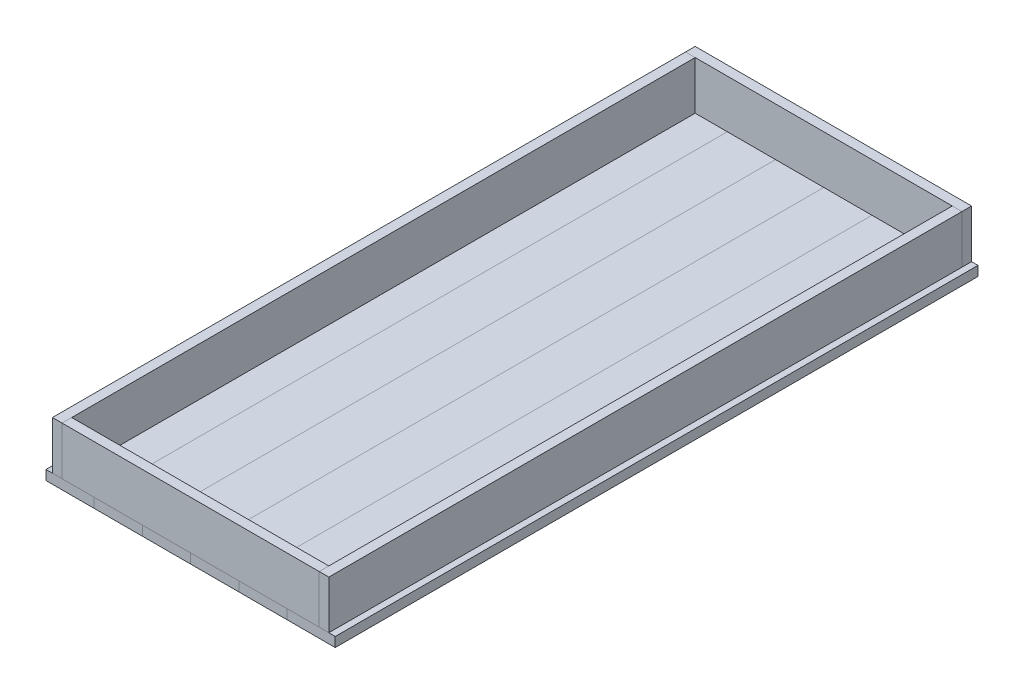
from build123d import *

# Parameters (mm, degrees)
SKETCH4_W            = 100
SKETCH4_H            = 1.5
BOSS_EXTRUDE3_DEPTH  = 7.5
BOSS_EXTRUDE4_START  = -7.5
SKETCH4_2_W          = 100
SKETCH4_2_H          = 1.5
BOSS_EXTRUDE4_DEPTH  = 7.5
LPATTERN7_COUNT      = 5
LPATTERN7_PITCH      = 7.5
BOSS_EXTRUDE5_START  = -100
SKETCH5_W            = 43
SKETCH5_H            = 7.5
BOSS_EXTRUDE5_DEPTH  = 1.5
BOSS_EXTRUDE7_START  = -1
SKETCH6_W            = 98.5
SKETCH6_H            = 7.5
BOSS_EXTRUDE7_DEPTH  = 1.5
BOSS_EXTRUDE8_START  = -44
SKETCH6_3_W          = 98.5
SKETCH6_3_H          = 7.5
BOSS_EXTRUDE8_DEPTH  = 1.5
SKETCH7_W            = 40
SKETCH7_H            = 7.5
BOSS_EXTRUDE10_DEPTH = 1.5
SCALE2_SCALE         = 10


with BuildPart() as part:
    # Sketch4 → Boss-Extrude3 (new body)
    with BuildSketch(Plane(origin=(0, 0, 0), x_dir=(0, 0, -1), z_dir=(1, 0, 0))):
        with Locations((50, 0.75)):
            Rectangle(SKETCH4_W, SKETCH4_H)
    extrude(amount=-BOSS_EXTRUDE3_DEPTH)


with BuildPart() as body_2:
    # Sketch4<2> → Boss-Extrude4 (new body)
    with BuildSketch(Plane(origin=(0, 0, 0), x_dir=(0, 0, -1), z_dir=(1, 0, 0)).offset(BOSS_EXTRUDE4_START)):
        with Locations((50, 0.75)):
            Rectangle(SKETCH4_2_W, SKETCH4_2_H)
    boss_extrude4 = extrude(amount=-BOSS_EXTRUDE4_DEPTH)


with BuildPart() as lpattern7_1:
    # LPattern7: pattern copy
    add(boss_extrude4.moved(Location(Vector(-1, 0, 0) * (1 * LPATTERN7_PITCH))))


with BuildPart() as lpattern7_2:
    # LPattern7: pattern copy
    add(boss_extrude4.moved(Location(Vector(-1, 0, 0) * (2 * LPATTERN7_PITCH))))


with BuildPart() as lpattern7_3:
    # LPattern7: pattern copy
    add(boss_extrude4.moved(Location(Vector(-1, 0, 0) * (3 * LPATTERN7_PITCH))))


with BuildPart() as lpattern7_4:
    # LPattern7: pattern copy
    add(boss_extrude4.moved(Location(Vector(-1, 0, 0) * (4 * LPATTERN7_PITCH))))


with BuildPart() as body_7:
    # Sketch5 → Boss-Extrude5 (new body)
    with BuildSketch(Plane.XY.offset(BOSS_EXTRUDE5_START)):
        with Locations((-22.5, 5.25)):
            Rectangle(SKETCH5_W, SKETCH5_H)
    extrude(amount=BOSS_EXTRUDE5_DEPTH)


with BuildPart() as body_8:
    # Sketch6 → Boss-Extrude7 (new body)
    with BuildSketch(Plane(origin=(0, 0, 0), x_dir=(0, 0, -1), z_dir=(1, 0, 0)).offset(BOSS_EXTRUDE7_START)):
        with Locations((49.25, 5.25)):
            Rectangle(SKETCH6_W, SKETCH6_H)
    extrude(amount=-BOSS_EXTRUDE7_DEPTH)


with BuildPart() as body_9:
    # Sketch6<3> → Boss-Extrude8 (new body)
    with BuildSketch(Plane(origin=(0, 0, 0), x_dir=(0, 0, -1), z_dir=(1, 0, 0)).offset(BOSS_EXTRUDE8_START)):
        with Locations((49.25, 5.25)):
            Rectangle(SKETCH6_3_W, SKETCH6_3_H)
    extrude(amount=BOSS_EXTRUDE8_DEPTH)


with BuildPart() as body_10:
    # Sketch7 → Boss-Extrude10 (new body)
    with BuildSketch(Plane.XY):
        with Locations((-22.5, 5.25)):
            Rectangle(SKETCH7_W, SKETCH7_H)
    extrude(amount=-BOSS_EXTRUDE10_DEPTH)


with BuildPart() as body_7_1:
    # Scale2: scaled about (0, 0, 0)
    add(body_7.part.scale(SCALE2_SCALE))


with BuildPart() as body_9_1:
    # Scale2: scaled about (0, 0, 0)
    add(body_9.part.scale(SCALE2_SCALE))


with BuildPart() as body_8_1:
    # Scale2: scaled about (0, 0, 0)
    add(body_8.part.scale(SCALE2_SCALE))


with BuildPart() as body_10_1:
    # Scale2: scaled about (0, 0, 0)
    add(body_10.part.scale(SCALE2_SCALE))


with BuildPart() as body_2_1:
    # Scale2: scaled about (0, 0, 0)
    add(body_2.part.scale(SCALE2_SCALE))


with BuildPart() as part_1:
    # Scale2: scaled about (0, 0, 0)
    add(part.part.scale(SCALE2_SCALE))


with BuildPart() as lpattern7_1_1:
    # Scale2: scaled about (0, 0, 0)
    add(lpattern7_1.part.scale(SCALE2_SCALE))


with BuildPart() as lpattern7_2_1:
    # Scale2: scaled about (0, 0, 0)
    add(lpattern7_2.part.scale(SCALE2_SCALE))


with BuildPart() as lpattern7_3_1:
    # Scale2: scaled about (0, 0, 0)
    add(lpattern7_3.part.scale(SCALE2_SCALE))


with BuildPart() as lpattern7_4_1:
    # Scale2: scaled about (0, 0, 0)
    add(lpattern7_4.part.scale(SCALE2_SCALE))


solid = Compound([body_7_1.part, body_9_1.part, body_8_1.part, body_10_1.part, body_2_1.part, part_1.part, lpattern7_1_1.part, lpattern7_2_1.part, lpattern7_3_1.part, lpattern7_4_1.part])
